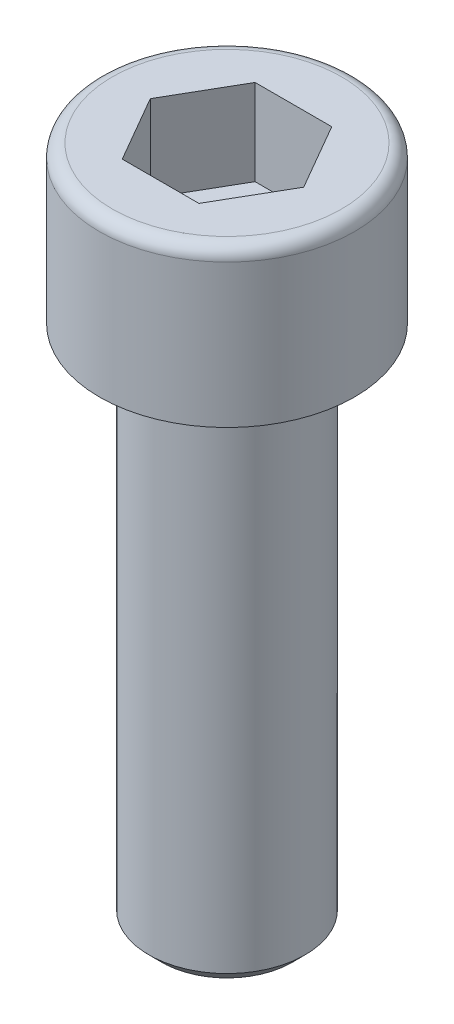
from build123d import *

# Parameters (mm, degrees)
ESQUISSE1_W             = 4.9
ESQUISSE1_H             = 6
ESQUISSE2_R             = 3
BOSS_EXTRU_1_DEPTH      = 20
ENL_V_MAT_EXTRU_1_DEPTH = 3.3
CHANFREIN1_SIZE         = 0.5
CONG_1_R                = 0.5


with BuildPart() as part:
    # Esquisse1 → Révolution1 (revolve)
    with BuildSketch(Plane.XY, mode=Mode.PRIVATE) as r_volution1_sk:
        with Locations((2.45, 3)):
            Rectangle(ESQUISSE1_W, ESQUISSE1_H)
    revolve(r_volution1_sk.sketch.rotate(Axis((0, 6, 0), (0, -1, 0)), 270), axis=Axis((0, 6, 0), (0, -1, 0)))

    # Esquisse2 → Boss.-Extru.1 (add)
    with BuildSketch(Plane.XZ):
        with Locations(Location((0, 0, 0), (0, 0, 270))):
            Circle(ESQUISSE2_R)
    extrude(amount=BOSS_EXTRU_1_DEPTH)

    # Esquisse3 → Enlèv. mat.-Extru.1 (cut)
    with BuildSketch(Plane(origin=(0, 6, 0), x_dir=(-1, 0, 0), z_dir=(0, 1, 0))):
        Polygon((1.472243186, 2.55), (-1.472243186, 2.55), (-2.944486373, 0), (-1.472243186, -2.55), (1.472243186, -2.55), (2.944486373, 0), align=None)
    extrude(amount=-ENL_V_MAT_EXTRU_1_DEPTH, mode=Mode.SUBTRACT)

    # Chanfrein1
    chanfrein1_edges = [part.edges().sort_by_distance(p)[0] for p in [
        (0, -20, 3),
    ]]
    chamfer(chanfrein1_edges, length=CHANFREIN1_SIZE)

    # Congé1
    cong_1_edges = [part.edges().sort_by_distance(p)[0] for p in [
        (0, 6, 4.9),
    ]]
    fillet(cong_1_edges, radius=CONG_1_R)


solid = part.part
